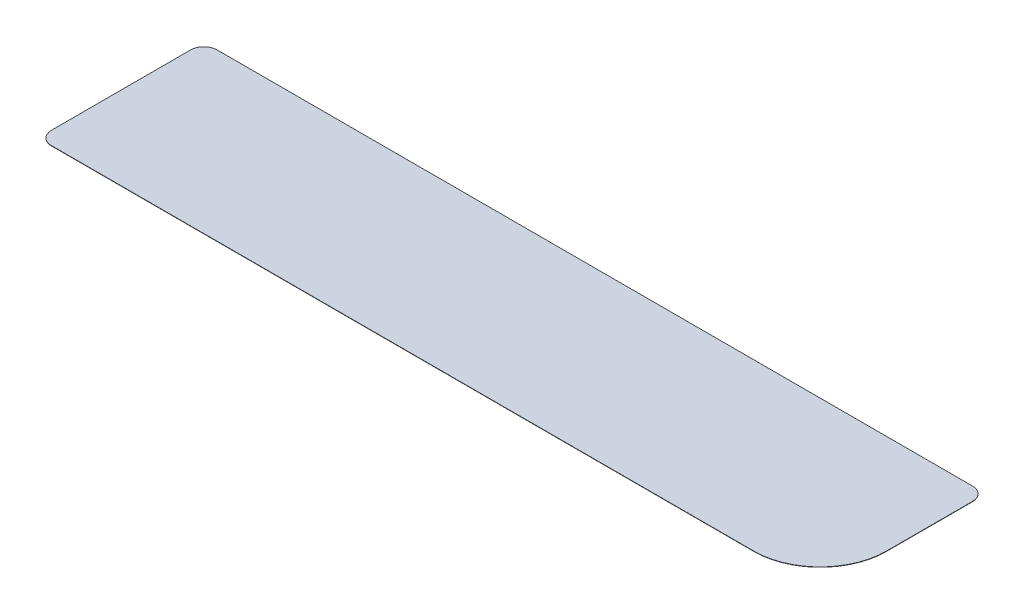
from build123d import *

# Parameters (mm, degrees)
BOSS_EXTRUDE1_DEPTH = 0.05


with BuildPart() as part:
    # Sketch1 → Boss-Extrude1 (new body)
    with BuildSketch(Plane(origin=(0, 0, 0), x_dir=(1, 0, 0), z_dir=(0, 1, 0))):
        with BuildLine():
            Line((2, 12.5), (116, 12.5))
            ThreePointArc((116, 12.5), (117.414213562, 11.914213562), (118, 10.5))
            Line((118, 10.5), (118, -2.5))
            ThreePointArc((118, -2.5), (115.071067812, -9.571067812), (108, -12.5))
            Line((108, -12.5), (2, -12.5))
            ThreePointArc((2, -12.5), (0.585786438, -11.914213562), (0, -10.5))
            Line((0, -10.5), (0, 10.5))
            ThreePointArc((0, 10.5), (0.585786438, 11.914213562), (2, 12.5))
        make_face()
    extrude(amount=BOSS_EXTRUDE1_DEPTH)


solid = part.part
